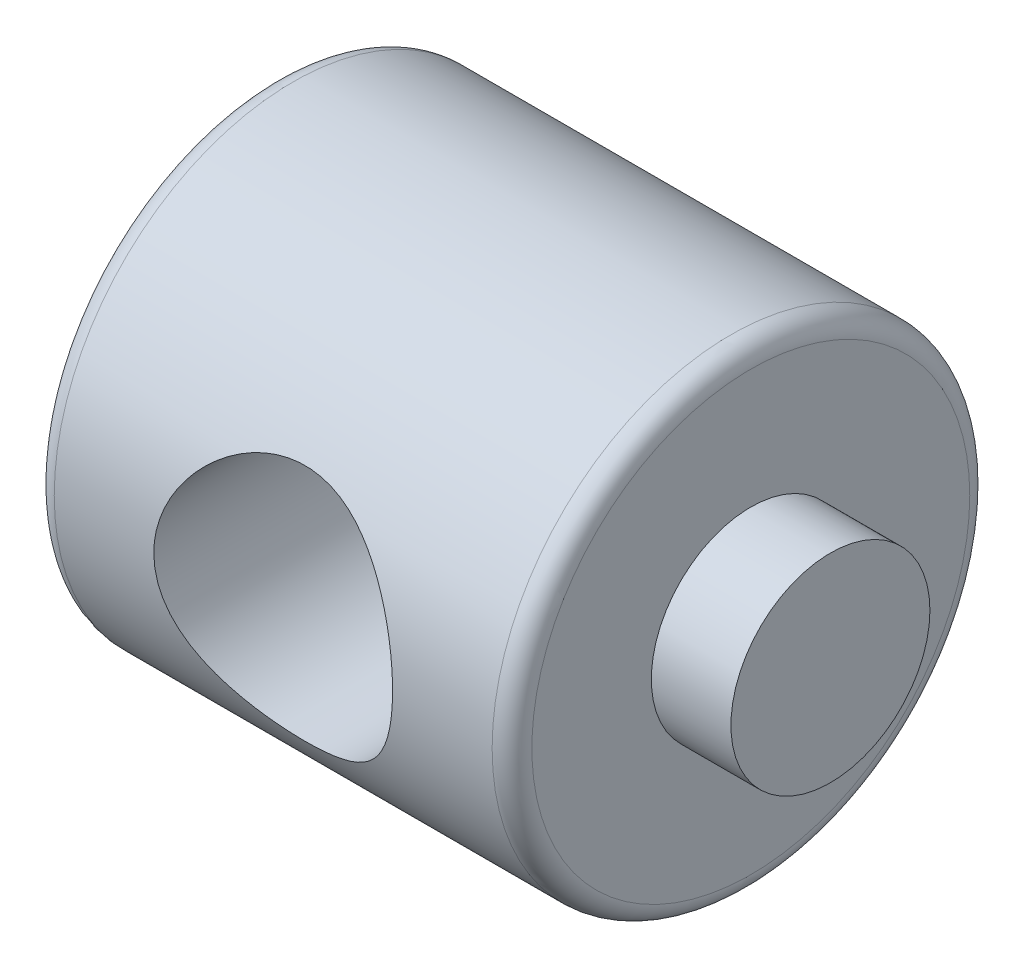
from build123d import *

# Parameters (mm, degrees)
SKETCH1_R               = 9.525
BOSS_EXTRUDE1_DEPTH     = 9.525
SKETCH2_R               = 3.96875
BOSS_EXTRUDE2_DEPTH     = 3.175
FILLET1_R               = 0.79248
BOSS_EXTRUDE3_START     = 3.175
SKETCH3_R               = 3.96875
BOSS_EXTRUDE3_DEPTH     = 3.175
CUT_EXTRUDE1_DEPTH      = 19.513272318
CUT_EXTRUDE1_DEPTH_BACK = 19.513272318
SKETCH13_R              = 4.7625


with BuildPart() as part:
    # Sketch1 → Boss-Extrude1 (new, symmetric)
    with BuildSketch(Plane(origin=(0, 0, 0), x_dir=(0, 0, -1), z_dir=(1, 0, 0))):
        with Locations(Location((0, 0, 0), (0, 0, 180))):
            Circle(SKETCH1_R)
    extrude(amount=BOSS_EXTRUDE1_DEPTH, both=True)

    # Sketch2 → Boss-Extrude2 (add)
    with BuildSketch(Plane(origin=(9.525, 0, 0), x_dir=(0, 0, -1), z_dir=(1, 0, 0))):
        Circle(SKETCH2_R)
    extrude(amount=BOSS_EXTRUDE2_DEPTH)

    # Fillet1
    fillet1_edges = [part.edges().sort_by_distance(p)[0] for p in [
        (-9.525, 0, -9.525),
        (9.525, 0, -9.525),
    ]]
    fillet(fillet1_edges, radius=FILLET1_R)

    # Sketch3 → Boss-Extrude3 (add)
    with BuildSketch(Plane.ZY.offset(9.525).offset(BOSS_EXTRUDE3_START)):
        with Locations(Location((0, 0, 0), (0, 0, 180))):
            Circle(SKETCH3_R)
    extrude(amount=-BOSS_EXTRUDE3_DEPTH)

    # Sketch13 → Cut-Extrude1 (cut, two sides: drawn at the far end of the back side and taken through both)
    with BuildSketch(Plane.XY.offset(-CUT_EXTRUDE1_DEPTH_BACK)):
        with Locations(Location((0, 0, 0), (0, 0, 180))):
            Circle(SKETCH13_R)
    extrude(amount=CUT_EXTRUDE1_DEPTH + CUT_EXTRUDE1_DEPTH_BACK, mode=Mode.SUBTRACT)


solid = part.part
